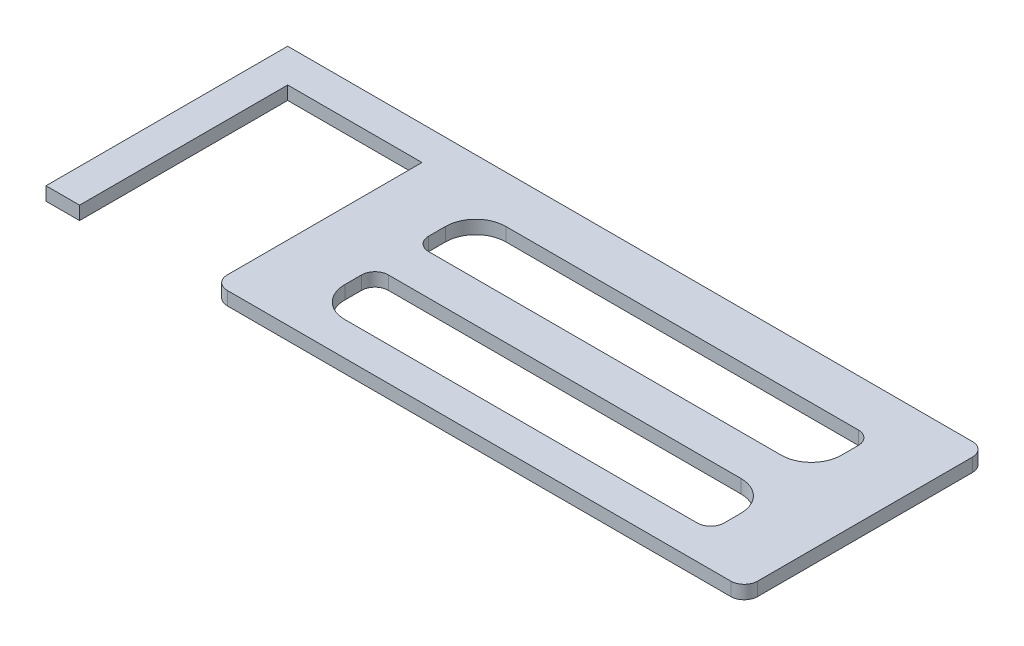
from build123d import *

# Parameters (mm, degrees)
BOSS_EXTRUDE1_DEPTH = 2


with BuildPart() as part:
    # Sketch1 → Boss-Extrude1 (new body)
    with BuildSketch(Plane(origin=(0, 0, 0), x_dir=(1, 0, 0), z_dir=(0, 1, 0))):
        with BuildLine():
            Line((-39.5, -16), (-39.5, 13))
            Line((-39.5, 13), (-59.5, 13))
            Line((-59.5, 13), (-59.5, -18))
            Line((-59.5, -18), (-64.5, -18))
            Line((-64.5, -18), (-64.5, 18))
            Line((-64.5, 18), (-39.5, 18))
            Line((-39.5, 18), (37.5, 18))
            ThreePointArc((37.5, 18), (38.914213562, 17.414213562), (39.5, 16))
            Line((39.5, 16), (39.5, -16))
            ThreePointArc((39.5, -16), (38.914213562, -17.414213562), (37.5, -18))
            Line((37.5, -18), (-37.5, -18))
            ThreePointArc((-37.5, -18), (-38.914213562, -17.414213562), (-39.5, -16))
        make_face()
        with BuildLine():
            Line((-25, 11), (27.5, 11))
            ThreePointArc((27.5, 11), (28.914213562, 10.414213562), (29.5, 9))
            Line((29.5, 9), (29.5, 6.5))
            ThreePointArc((29.5, 6.5), (28.181980515, 3.318019485), (25, 2))
            Line((25, 2), (-27.5, 2))
            ThreePointArc((-27.5, 2), (-28.914213562, 2.585786438), (-29.5, 4))
            Line((-29.5, 4), (-29.5, 6.5))
            ThreePointArc((-29.5, 6.5), (-28.181980515, 9.681980515), (-25, 11))
        make_face(mode=Mode.SUBTRACT)
        with BuildLine():
            Line((-27.5, -4), (25, -4))
            ThreePointArc((25, -4), (28.181980515, -5.318019485), (29.5, -8.5))
            Line((29.5, -8.5), (29.5, -11))
            ThreePointArc((29.5, -11), (28.914213562, -12.414213562), (27.5, -13))
            Line((27.5, -13), (-25, -13))
            ThreePointArc((-25, -13), (-28.181980515, -11.681980515), (-29.5, -8.5))
            Line((-29.5, -8.5), (-29.5, -6))
            ThreePointArc((-29.5, -6), (-28.914213562, -4.585786438), (-27.5, -4))
        make_face(mode=Mode.SUBTRACT)
    extrude(amount=BOSS_EXTRUDE1_DEPTH)


solid = part.part
